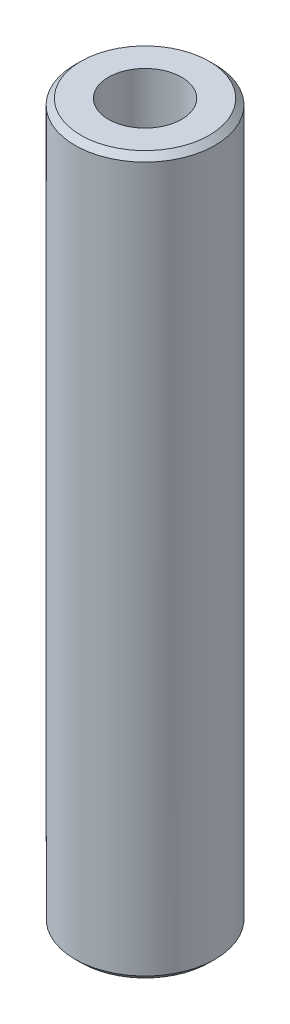
from build123d import *

# Parameters (mm, degrees)
CROQUIS2_R                = 4.7625
SALIENTE_EXTRUIR1_DEPTH   = 24.384
CHAFL_N1_SIZE             = 0.396875
CLEARANCE_HOLE_DEPTH      = 26.297080237
CLEARANCE_HOLE_DEPTH_BACK = 26.297080237
CROQUIS4_R                = 2.4892


with BuildPart() as part:
    # Croquis2 → Saliente-Extruir1 (new, symmetric)
    with BuildSketch(Plane(origin=(0, 0, 0), x_dir=(1, 0, 0), z_dir=(0, 1, 0))):
        Circle(CROQUIS2_R)
    extrude(amount=SALIENTE_EXTRUIR1_DEPTH, both=True)

    # Chaflán1
    chafl_n1_edges = [part.edges().sort_by_distance(p)[0] for p in [
        (-4.7625, -24.384, 0),
        (-4.7625, 24.384, 0),
    ]]
    chamfer(chafl_n1_edges, length=CHAFL_N1_SIZE)

    # Croquis4 → Clearance Hole (cut, two sides: drawn at the far end of the back side and taken through both)
    with BuildSketch(Plane(origin=(0, 0, 0), x_dir=(1, 0, 0), z_dir=(0, 1, 0)).offset(-CLEARANCE_HOLE_DEPTH_BACK)):
        Circle(CROQUIS4_R)
    extrude(amount=CLEARANCE_HOLE_DEPTH + CLEARANCE_HOLE_DEPTH_BACK, mode=Mode.SUBTRACT)


solid = part.part
